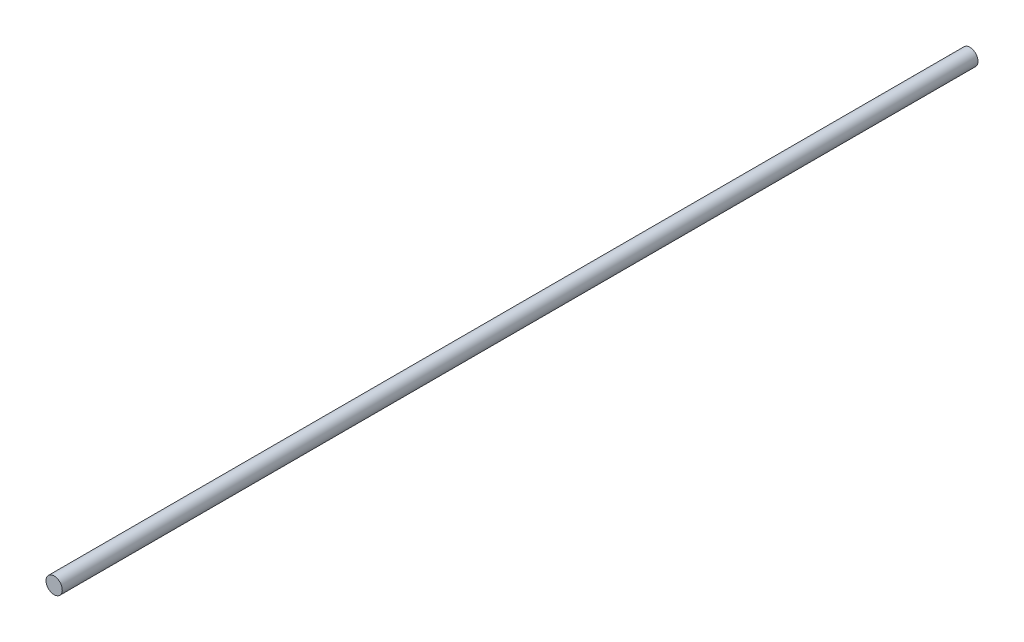
from build123d import *

# Parameters (mm, degrees)
SKETCH_1_R      = 4
EXTRUDE_1_DEPTH = 450


with BuildPart() as part:
    # 草图1 → 凸台-拉伸1 (new body)
    with BuildSketch(Plane.XY):
        Circle(SKETCH_1_R)
    extrude(amount=EXTRUDE_1_DEPTH)


solid = part.part
